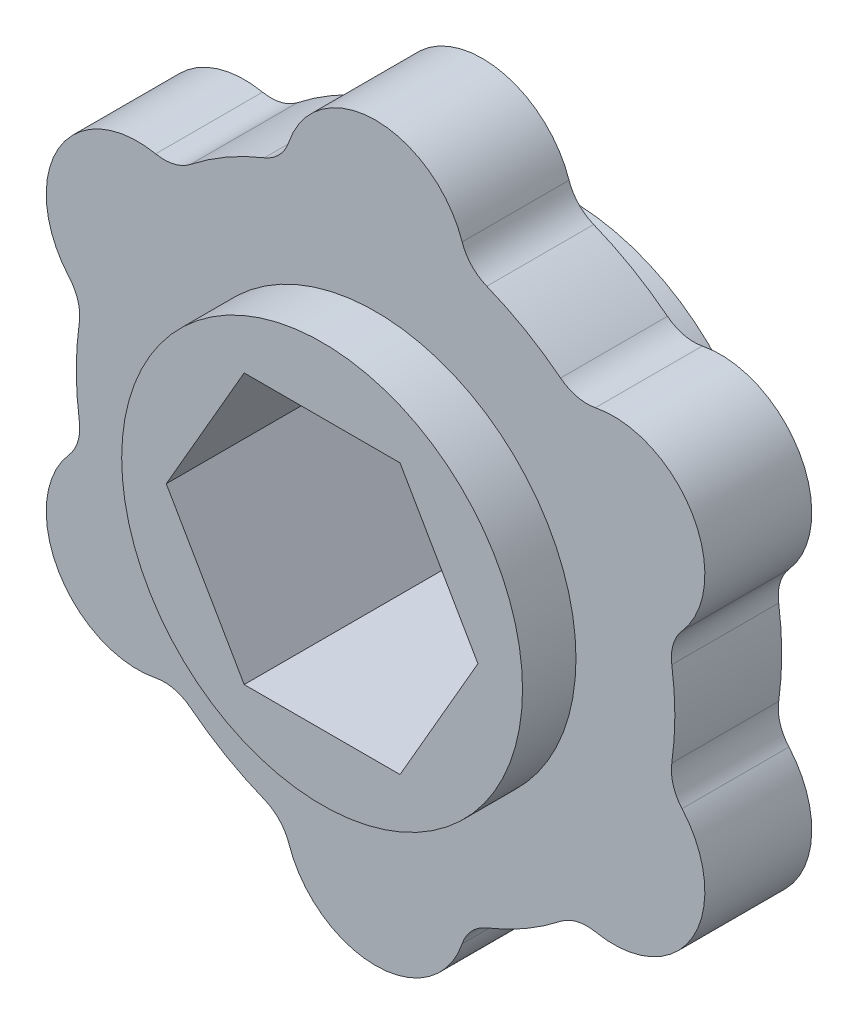
from build123d import *

# Parameters (mm, degrees)
BOSS_EXTRUDE2_DEPTH      = 5.08
FILLET1_R                = 2.032
CUT_EXTRUDE1_DEPTH       = 24.94682426
BOSS_EXTRUDE3_DEPTH      = 4.143000096
BOSS_EXTRUDE3_DEPTH_BACK = 7.62
SKETCH7_R                = 9.525


with BuildPart() as part:
    # Sketch5 → Boss-Extrude2 (new body)
    with BuildSketch(Plane.XY):
        with BuildLine():
            ThreePointArc((13.895294195, 3.040226179), (15.067976, 8.6995), (9.580560202, 10.513564677))
            ThreePointArc((9.580560202, 10.513564677), (7.112, 12.318345343), (4.314733993, 13.553790856))
            ThreePointArc((4.314733993, 13.553790856), (0, 17.399), (-4.314733993, 13.553790856))
            ThreePointArc((-4.314733993, 13.553790856), (-7.112, 12.318345343), (-9.580560202, 10.513564677))
            ThreePointArc((-9.580560202, 10.513564677), (-15.067976, 8.6995), (-13.895294195, 3.040226179))
            ThreePointArc((-13.895294195, 3.040226179), (-14.224, 0), (-13.895294195, -3.040226179))
            ThreePointArc((-13.895294195, -3.040226179), (-15.067976, -8.6995), (-9.580560202, -10.513564677))
            ThreePointArc((-9.580560202, -10.513564677), (-7.112, -12.318345343), (-4.314733993, -13.553790856))
            ThreePointArc((-4.314733993, -13.553790856), (0, -17.399), (4.314733993, -13.553790856))
            ThreePointArc((4.314733993, -13.553790856), (7.112, -12.318345343), (9.580560202, -10.513564677))
            ThreePointArc((9.580560202, -10.513564677), (15.067976, -8.6995), (13.895294195, -3.040226179))
            ThreePointArc((13.895294195, -3.040226179), (14.224, 0), (13.895294195, 3.040226179))
        make_face()
    extrude(amount=BOSS_EXTRUDE2_DEPTH)

    # Fillet1
    fillet1_edges = [part.edges().sort_by_distance(p)[0] for p in [
        (-4.314733993, 13.553790856, 2.54),
        (4.314733993, 13.553790856, 2.54),
        (9.580560202, 10.513564677, 2.54),
        (13.895294195, 3.040226179, 2.54),
        (13.895294195, -3.040226179, 2.54),
        (9.580560202, -10.513564677, 2.54),
        (4.314733993, -13.553790856, 2.54),
        (-4.314733993, -13.553790856, 2.54),
        (-9.580560202, -10.513564677, 2.54),
        (-13.895294195, -3.040226179, 2.54),
        (-9.580560202, 10.513564677, 2.54),
        (-13.895294195, 3.040226179, 2.54),
    ]]
    fillet(fillet1_edges, radius=FILLET1_R)

    # Sketch6 → Cut-Extrude1 (cut, through all)
    with BuildSketch(Plane.XY.offset(5.08)):
        Polygon((7.405671903, 0), (3.702835951, 6.4135), (-3.702835951, 6.4135), (-7.405671903, 0), (-3.702835951, -6.4135), (3.702835951, -6.4135), align=None)
    extrude(amount=-CUT_EXTRUDE1_DEPTH, mode=Mode.SUBTRACT)

    # Sketch7 → Boss-Extrude3 (add, two sides: drawn at the far end of the back side and taken through both)
    with BuildSketch(Plane(origin=(0, 0, 0), x_dir=(-1, 0, 0), z_dir=(0, 0, -1)).offset(-BOSS_EXTRUDE3_DEPTH_BACK)):
        Circle(SKETCH7_R)
        Polygon((-7.405671903, 0), (-3.702835951, 6.4135), (3.702835951, 6.4135), (7.405671903, 0), (3.702835951, -6.4135), (-3.702835951, -6.4135), align=None, mode=Mode.SUBTRACT)
    extrude(amount=BOSS_EXTRUDE3_DEPTH + BOSS_EXTRUDE3_DEPTH_BACK)


solid = part.part
